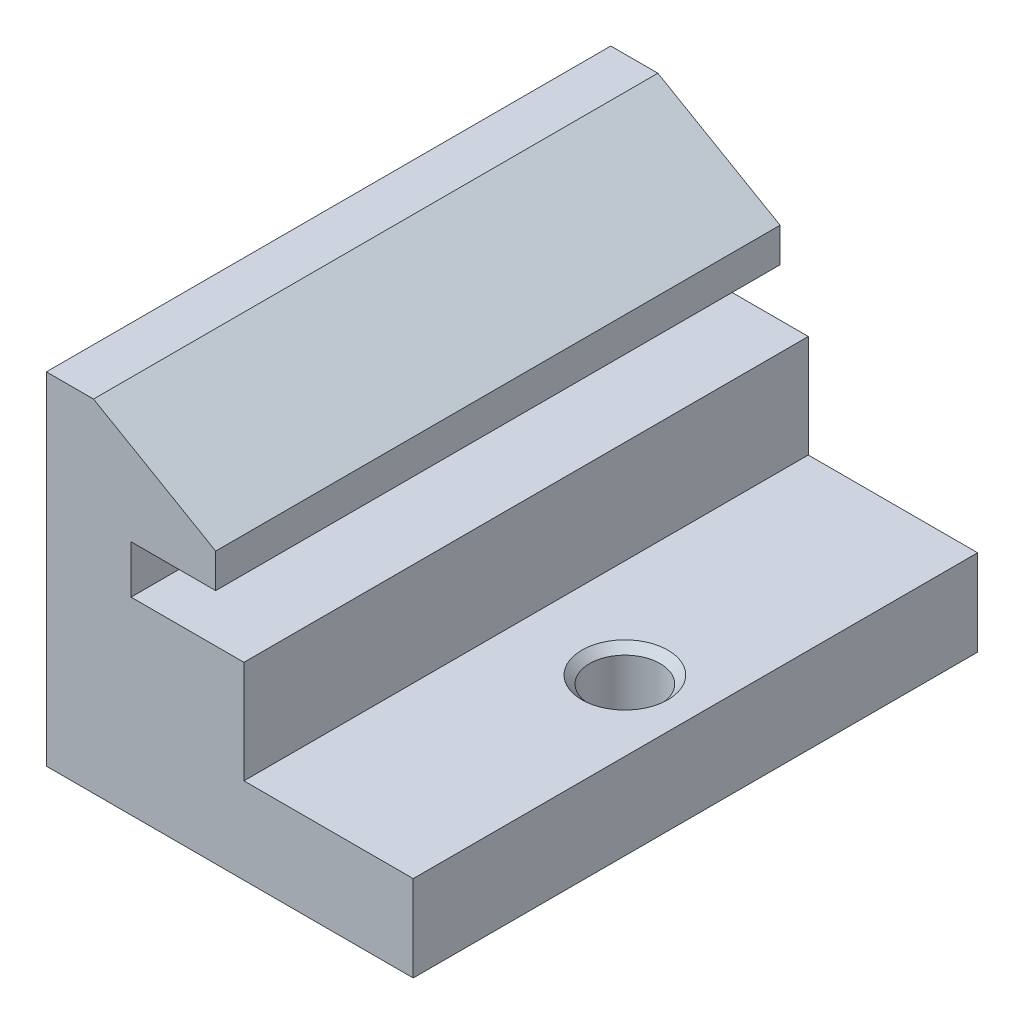
from build123d import *

# Parameters (mm, degrees)
BOSS_EXTRUDE1_DEPTH             = 20
M3X0_5_TAPPED_HOLE1_D           = 2.5
M3X0_5_TAPPED_HOLE1_CSINK_D     = 3.05
M3X0_5_TAPPED_HOLE1_CSINK_ANGLE = 90
CHAMFER1_SIZE                   = 2.5
CHAMFER1_SIZE2                  = 4.330127019


with BuildPart() as part:
    # Sketch1 → Boss-Extrude1 (new body)
    with BuildSketch(Plane.XY):
        Polygon((0, 0), (4, 0), (4, -3.637956731), (10, -3.637956731), (10, -6.68821772), (-3, -6.68821772), (-3, 5.414430721), (3, 5.414430721), (3, 1.7), (0, 1.7), align=None)
    extrude(amount=BOSS_EXTRUDE1_DEPTH)

    # M3x0.5 Tapped Hole1 (through all)
    with Locations(Plane(origin=(0, -3.637956731, 0), x_dir=(1, 0, 0), z_dir=(0, 1, 0))):
        with Locations((7.5, -10)):
            CounterSinkHole(M3X0_5_TAPPED_HOLE1_D / 2, M3X0_5_TAPPED_HOLE1_CSINK_D / 2, counter_sink_angle=M3X0_5_TAPPED_HOLE1_CSINK_ANGLE)

    # Chamfer1
    chamfer1_edges = [part.edges().sort_by_distance(p)[0] for p in [
        (3, 5.414430721, 10),
    ]]
    chamfer1_side = [part.faces().sort_by_distance(p)[0] for p in [
        (3, 3.55721536, 10),
    ]]
    chamfer(chamfer1_edges, length=CHAMFER1_SIZE, length2=CHAMFER1_SIZE2, reference=chamfer1_side[0])


solid = part.part
